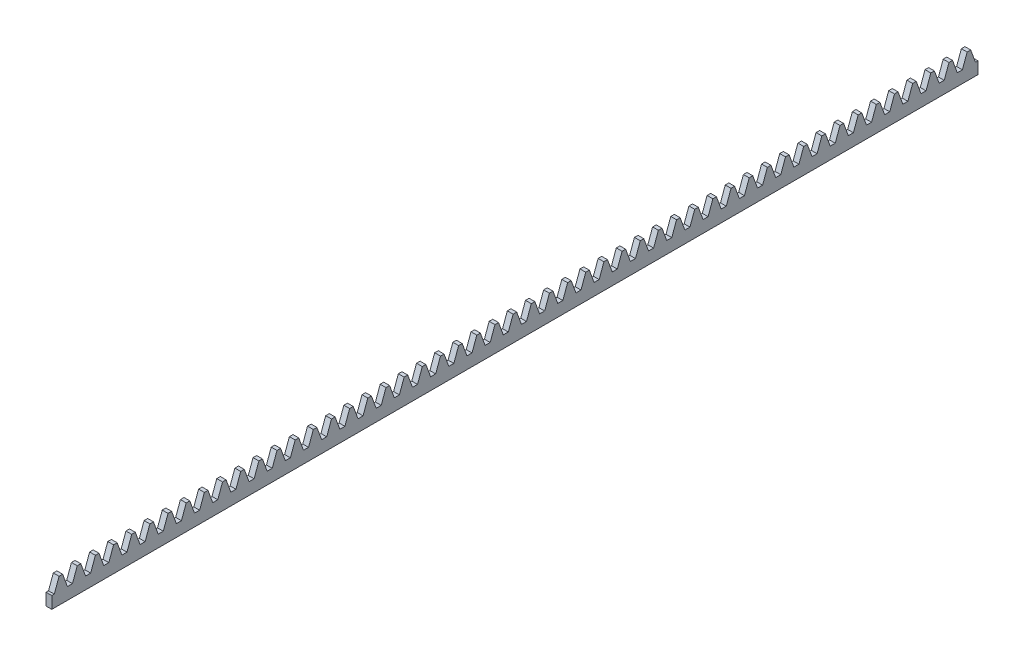
from build123d import *

# Parameters (mm, degrees)
ESBO_O1_W                = 3
ESBO_O1_H                = 13
RESSALTO_EXTRUS_O1_DEPTH = 480.664
CORTE_EXTRUS_O1_DEPTH    = 481.849124878


with BuildPart() as part:
    # Esboço1 → Ressalto-extrusão1 (new body)
    with BuildSketch(Plane.XY):
        with Locations((1.5, 6.5)):
            Rectangle(ESBO_O1_W, ESBO_O1_H)
    extrude(amount=RESSALTO_EXTRUS_O1_DEPTH)

    # Esboço2 → Corte-extrusão1 (cut, through all)
    with BuildSketch(Plane.ZY):
        Polygon((1.312306109, 6.2246), (-1.312306109, 6.2246), (-3.778350034, 13), (3.778350034, 13), align=None)
        Polygon((10.737084059, 6.2246), (8.112471841, 6.2246), (5.646427916, 13), (13.203127984, 13), align=None)
        Polygon((20.161862009, 6.2246), (17.537249791, 6.2246), (15.071205866, 13), (22.627905934, 13), align=None)
        Polygon((29.586639959, 6.2246), (26.962027741, 6.2246), (24.495983816, 13), (32.052683884, 13), align=None)
        Polygon((39.011417909, 6.2246), (36.386805691, 6.2246), (33.920761766, 13), (41.477461834, 13), align=None)
        Polygon((48.436195859, 6.2246), (45.811583641, 6.2246), (43.345539716, 13), (50.902239784, 13), align=None)
        Polygon((57.860973809, 6.2246), (55.236361591, 6.2246), (52.770317666, 13), (60.327017734, 13), align=None)
        Polygon((67.285751759, 6.2246), (64.661139541, 6.2246), (62.195095616, 13), (69.751795684, 13), align=None)
        Polygon((76.710529709, 6.2246), (74.085917491, 6.2246), (71.619873566, 13), (79.176573634, 13), align=None)
        Polygon((86.135307659, 6.2246), (83.510695441, 6.2246), (81.044651516, 13), (88.601351584, 13), align=None)
        Polygon((95.560085609, 6.2246), (92.935473391, 6.2246), (90.469429466, 13), (98.026129534, 13), align=None)
        Polygon((104.984863559, 6.2246), (102.360251341, 6.2246), (99.894207416, 13), (107.450907484, 13), align=None)
        Polygon((114.409641509, 6.2246), (111.785029291, 6.2246), (109.318985366, 13), (116.875685434, 13), align=None)
        Polygon((123.834419459, 6.2246), (121.209807241, 6.2246), (118.743763316, 13), (126.300463384, 13), align=None)
        Polygon((133.259197409, 6.2246), (130.634585191, 6.2246), (128.168541266, 13), (135.725241334, 13), align=None)
        Polygon((142.683975359, 6.2246), (140.059363141, 6.2246), (137.593319216, 13), (145.150019284, 13), align=None)
        Polygon((152.108753309, 6.2246), (149.484141091, 6.2246), (147.018097166, 13), (154.574797234, 13), align=None)
        Polygon((161.533531259, 6.2246), (158.908919041, 6.2246), (156.442875116, 13), (163.999575184, 13), align=None)
        Polygon((170.958309209, 6.2246), (168.333696991, 6.2246), (165.867653066, 13), (173.424353134, 13), align=None)
        Polygon((180.383087159, 6.2246), (177.758474941, 6.2246), (175.292431016, 13), (182.849131084, 13), align=None)
        Polygon((189.807865109, 6.2246), (187.183252891, 6.2246), (184.717208966, 13), (192.273909034, 13), align=None)
        Polygon((199.232643059, 6.2246), (196.608030841, 6.2246), (194.141986916, 13), (201.698686984, 13), align=None)
        Polygon((208.657421009, 6.2246), (206.032808791, 6.2246), (203.566764866, 13), (211.123464934, 13), align=None)
        Polygon((218.082198959, 6.2246), (215.457586741, 6.2246), (212.991542816, 13), (220.548242884, 13), align=None)
        Polygon((227.506976909, 6.2246), (224.882364691, 6.2246), (222.416320766, 13), (229.973020834, 13), align=None)
        Polygon((236.931754859, 6.2246), (234.307142641, 6.2246), (231.841098716, 13), (239.397798784, 13), align=None)
        Polygon((246.356532809, 6.2246), (243.731920591, 6.2246), (241.265876666, 13), (248.822576734, 13), align=None)
        Polygon((255.781310759, 6.2246), (253.156698541, 6.2246), (250.690654616, 13), (258.247354684, 13), align=None)
        Polygon((265.206088709, 6.2246), (262.581476491, 6.2246), (260.115432566, 13), (267.672132634, 13), align=None)
        Polygon((274.630866659, 6.2246), (272.006254441, 6.2246), (269.540210516, 13), (277.096910584, 13), align=None)
        Polygon((284.055644609, 6.2246), (281.431032391, 6.2246), (278.964988466, 13), (286.521688534, 13), align=None)
        Polygon((293.480422559, 6.2246), (290.855810341, 6.2246), (288.389766416, 13), (295.946466484, 13), align=None)
        Polygon((302.905200509, 6.2246), (300.280588291, 6.2246), (297.814544366, 13), (305.371244434, 13), align=None)
        Polygon((312.329978459, 6.2246), (309.705366241, 6.2246), (307.239322316, 13), (314.796022384, 13), align=None)
        Polygon((321.754756409, 6.2246), (319.130144191, 6.2246), (316.664100266, 13), (324.220800334, 13), align=None)
        Polygon((331.179534359, 6.2246), (328.554922141, 6.2246), (326.088878216, 13), (333.645578284, 13), align=None)
        Polygon((340.604312309, 6.2246), (337.979700091, 6.2246), (335.513656166, 13), (343.070356234, 13), align=None)
        Polygon((350.029090259, 6.2246), (347.404478041, 6.2246), (344.938434116, 13), (352.495134184, 13), align=None)
        Polygon((359.453868209, 6.2246), (356.829255991, 6.2246), (354.363212066, 13), (361.919912134, 13), align=None)
        Polygon((368.878646159, 6.2246), (366.254033941, 6.2246), (363.787990016, 13), (371.344690084, 13), align=None)
        Polygon((378.303424109, 6.2246), (375.678811891, 6.2246), (373.212767966, 13), (380.769468034, 13), align=None)
        Polygon((387.728202059, 6.2246), (385.103589841, 6.2246), (382.637545916, 13), (390.194245984, 13), align=None)
        Polygon((397.152980009, 6.2246), (394.528367791, 6.2246), (392.062323866, 13), (399.619023934, 13), align=None)
        Polygon((406.577757959, 6.2246), (403.953145741, 6.2246), (401.487101816, 13), (409.043801884, 13), align=None)
        Polygon((416.002535909, 6.2246), (413.377923691, 6.2246), (410.911879766, 13), (418.468579834, 13), align=None)
        Polygon((425.427313859, 6.2246), (422.802701641, 6.2246), (420.336657716, 13), (427.893357784, 13), align=None)
        Polygon((434.852091809, 6.2246), (432.227479591, 6.2246), (429.761435666, 13), (437.318135734, 13), align=None)
        Polygon((444.276869759, 6.2246), (441.652257541, 6.2246), (439.186213616, 13), (446.742913684, 13), align=None)
        Polygon((453.701647709, 6.2246), (451.077035491, 6.2246), (448.610991566, 13), (456.167691634, 13), align=None)
        Polygon((463.126425659, 6.2246), (460.501813441, 6.2246), (458.035769516, 13), (465.592469584, 13), align=None)
        Polygon((472.551203609, 6.2246), (469.926591391, 6.2246), (467.460547466, 13), (475.017247534, 13), align=None)
        Polygon((481.975981559, 6.2246), (479.351369341, 6.2246), (476.885325416, 13), (484.442025484, 13), align=None)
    extrude(amount=-CORTE_EXTRUS_O1_DEPTH, mode=Mode.SUBTRACT)


solid = part.part
